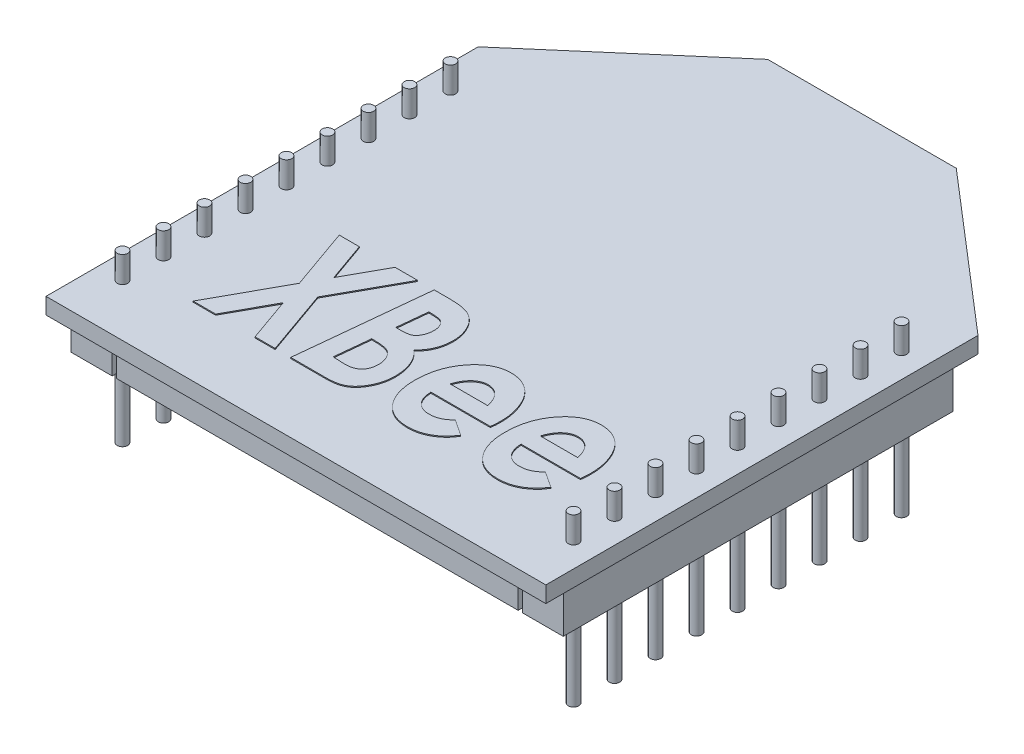
from build123d import *

# Parameters (mm, degrees)
BOSS_EXTRUDE2_DEPTH         = 0.79
SKETCH3_W                   = 2
SKETCH3_H                   = 19
SKETCH3_W_2                 = 19.6
BOSS_EXTRUDE3_DEPTH         = 2
BOSS_EXTRUDE4_DEPTH         = 1.27
BOSS_EXTRUDE4_DEPTH_BACK    = 6.85
SKETCH4_R                   = 0.255
BOSS_EXTRUDE4_2_DEPTH       = 1.27
BOSS_EXTRUDE4_2_DEPTH_BACK  = 6.85
BOSS_EXTRUDE4_3_DEPTH       = 1.27
BOSS_EXTRUDE4_3_DEPTH_BACK  = 6.85
BOSS_EXTRUDE4_4_DEPTH       = 1.27
BOSS_EXTRUDE4_4_DEPTH_BACK  = 6.85
BOSS_EXTRUDE4_5_DEPTH       = 1.27
BOSS_EXTRUDE4_5_DEPTH_BACK  = 6.85
BOSS_EXTRUDE4_6_DEPTH       = 1.27
BOSS_EXTRUDE4_6_DEPTH_BACK  = 6.85
BOSS_EXTRUDE4_7_DEPTH       = 1.27
BOSS_EXTRUDE4_7_DEPTH_BACK  = 6.85
BOSS_EXTRUDE4_8_DEPTH       = 1.27
BOSS_EXTRUDE4_8_DEPTH_BACK  = 6.85
BOSS_EXTRUDE4_9_DEPTH       = 1.27
BOSS_EXTRUDE4_9_DEPTH_BACK  = 6.85
BOSS_EXTRUDE4_10_DEPTH      = 1.27
BOSS_EXTRUDE4_10_DEPTH_BACK = 6.85
BOSS_EXTRUDE4_11_DEPTH      = 1.27
BOSS_EXTRUDE4_11_DEPTH_BACK = 6.85
BOSS_EXTRUDE4_12_DEPTH      = 1.27
BOSS_EXTRUDE4_12_DEPTH_BACK = 6.85
BOSS_EXTRUDE4_13_DEPTH      = 1.27
BOSS_EXTRUDE4_13_DEPTH_BACK = 6.85
BOSS_EXTRUDE4_14_DEPTH      = 1.27
BOSS_EXTRUDE4_14_DEPTH_BACK = 6.85
BOSS_EXTRUDE4_15_DEPTH      = 1.27
BOSS_EXTRUDE4_15_DEPTH_BACK = 6.85
BOSS_EXTRUDE4_16_DEPTH      = 1.27
BOSS_EXTRUDE4_16_DEPTH_BACK = 6.85
BOSS_EXTRUDE4_17_DEPTH      = 1.27
BOSS_EXTRUDE4_17_DEPTH_BACK = 6.85
BOSS_EXTRUDE4_18_DEPTH      = 1.27
BOSS_EXTRUDE4_18_DEPTH_BACK = 6.85
BOSS_EXTRUDE8_DEPTH         = 0.05
BOSS_EXTRUDE8_2_DEPTH       = 0.05
BOSS_EXTRUDE8_3_DEPTH       = 0.05
BOSS_EXTRUDE8_4_DEPTH       = 0.05


with BuildPart() as part:
    # Sketch1 → Boss-Extrude2 (new body)
    with BuildSketch(Plane(origin=(0, 0, 0), x_dir=(1, 0, 0), z_dir=(0, 1, 0))):
        Polygon((0, 0), (0, 21.08), (7.59, 27.61), (16.79, 27.61), (24.38, 21.08), (24.38, 0), align=None)
    extrude(amount=BOSS_EXTRUDE2_DEPTH)

    # Sketch3 → Boss-Extrude3 (add)
    with BuildSketch(Plane.XZ):
        with Locations((23.19, -10.54)):
            Rectangle(SKETCH3_W, SKETCH3_H)
        with Locations((1.19, -10.54)):
            Rectangle(SKETCH3_W, SKETCH3_H)
        with Locations((12.19, -10.54)):
            Rectangle(SKETCH3_W_2, SKETCH3_H)
    extrude(amount=BOSS_EXTRUDE3_DEPTH)


with BuildPart() as body_2:
    # Sketch4 → Boss-Extrude4 (new, two sides: drawn at the far end of the back side and taken through both)
    with BuildSketch(Plane(origin=(0, 0.79, 0), x_dir=(1, 0, 0), z_dir=(0, 1, 0)).offset(-BOSS_EXTRUDE4_DEPTH_BACK)):
        with Locations(Location((1.19, 10.54, 0), (0, 0, 270))):
            Circle(SKETCH4_R)
    extrude(amount=BOSS_EXTRUDE4_DEPTH + BOSS_EXTRUDE4_DEPTH_BACK)


with BuildPart() as body_3:
    # Sketch4 → Boss-Extrude4 2 (new, two sides: drawn at the far end of the back side and taken through both)
    with BuildSketch(Plane(origin=(0, 0.79, 0), x_dir=(1, 0, 0), z_dir=(0, 1, 0)).offset(-BOSS_EXTRUDE4_2_DEPTH_BACK)):
        with Locations(Location((1.19, 12.54, 0), (0, 0, 270))):
            Circle(SKETCH4_R)
    extrude(amount=BOSS_EXTRUDE4_2_DEPTH + BOSS_EXTRUDE4_2_DEPTH_BACK)


with BuildPart() as body_4:
    # Sketch4 → Boss-Extrude4 3 (new, two sides: drawn at the far end of the back side and taken through both)
    with BuildSketch(Plane(origin=(0, 0.79, 0), x_dir=(1, 0, 0), z_dir=(0, 1, 0)).offset(-BOSS_EXTRUDE4_3_DEPTH_BACK)):
        with Locations(Location((1.19, 14.54, 0), (0, 0, 270))):
            Circle(SKETCH4_R)
    extrude(amount=BOSS_EXTRUDE4_3_DEPTH + BOSS_EXTRUDE4_3_DEPTH_BACK)


with BuildPart() as body_5:
    # Sketch4 → Boss-Extrude4 4 (new, two sides: drawn at the far end of the back side and taken through both)
    with BuildSketch(Plane(origin=(0, 0.79, 0), x_dir=(1, 0, 0), z_dir=(0, 1, 0)).offset(-BOSS_EXTRUDE4_4_DEPTH_BACK)):
        with Locations(Location((1.19, 16.54, 0), (0, 0, 270))):
            Circle(SKETCH4_R)
    extrude(amount=BOSS_EXTRUDE4_4_DEPTH + BOSS_EXTRUDE4_4_DEPTH_BACK)


with BuildPart() as body_6:
    # Sketch4 → Boss-Extrude4 5 (new, two sides: drawn at the far end of the back side and taken through both)
    with BuildSketch(Plane(origin=(0, 0.79, 0), x_dir=(1, 0, 0), z_dir=(0, 1, 0)).offset(-BOSS_EXTRUDE4_5_DEPTH_BACK)):
        with Locations(Location((1.19, 18.54, 0), (0, 0, 270))):
            Circle(SKETCH4_R)
    extrude(amount=BOSS_EXTRUDE4_5_DEPTH + BOSS_EXTRUDE4_5_DEPTH_BACK)


with BuildPart() as body_7:
    # Sketch4 → Boss-Extrude4 6 (new, two sides: drawn at the far end of the back side and taken through both)
    with BuildSketch(Plane(origin=(0, 0.79, 0), x_dir=(1, 0, 0), z_dir=(0, 1, 0)).offset(-BOSS_EXTRUDE4_6_DEPTH_BACK)):
        with Locations(Location((1.19, 8.54, 0), (0, 0, 270))):
            Circle(SKETCH4_R)
    extrude(amount=BOSS_EXTRUDE4_6_DEPTH + BOSS_EXTRUDE4_6_DEPTH_BACK)


with BuildPart() as body_8:
    # Sketch4 → Boss-Extrude4 7 (new, two sides: drawn at the far end of the back side and taken through both)
    with BuildSketch(Plane(origin=(0, 0.79, 0), x_dir=(1, 0, 0), z_dir=(0, 1, 0)).offset(-BOSS_EXTRUDE4_7_DEPTH_BACK)):
        with Locations(Location((1.19, 6.54, 0), (0, 0, 270))):
            Circle(SKETCH4_R)
    extrude(amount=BOSS_EXTRUDE4_7_DEPTH + BOSS_EXTRUDE4_7_DEPTH_BACK)


with BuildPart() as body_9:
    # Sketch4 → Boss-Extrude4 8 (new, two sides: drawn at the far end of the back side and taken through both)
    with BuildSketch(Plane(origin=(0, 0.79, 0), x_dir=(1, 0, 0), z_dir=(0, 1, 0)).offset(-BOSS_EXTRUDE4_8_DEPTH_BACK)):
        with Locations(Location((1.19, 4.54, 0), (0, 0, 270))):
            Circle(SKETCH4_R)
    extrude(amount=BOSS_EXTRUDE4_8_DEPTH + BOSS_EXTRUDE4_8_DEPTH_BACK)


with BuildPart() as body_10:
    # Sketch4 → Boss-Extrude4 9 (new, two sides: drawn at the far end of the back side and taken through both)
    with BuildSketch(Plane(origin=(0, 0.79, 0), x_dir=(1, 0, 0), z_dir=(0, 1, 0)).offset(-BOSS_EXTRUDE4_9_DEPTH_BACK)):
        with Locations(Location((1.19, 2.54, 0), (0, 0, 270))):
            Circle(SKETCH4_R)
    extrude(amount=BOSS_EXTRUDE4_9_DEPTH + BOSS_EXTRUDE4_9_DEPTH_BACK)


with BuildPart() as body_11:
    # Sketch4 → Boss-Extrude4 10 (new, two sides: drawn at the far end of the back side and taken through both)
    with BuildSketch(Plane(origin=(0, 0.79, 0), x_dir=(1, 0, 0), z_dir=(0, 1, 0)).offset(-BOSS_EXTRUDE4_10_DEPTH_BACK)):
        with Locations(Location((23.19, 2.54, 0), (0, 0, 90))):
            Circle(SKETCH4_R)
    extrude(amount=BOSS_EXTRUDE4_10_DEPTH + BOSS_EXTRUDE4_10_DEPTH_BACK)


with BuildPart() as body_12:
    # Sketch4 → Boss-Extrude4 11 (new, two sides: drawn at the far end of the back side and taken through both)
    with BuildSketch(Plane(origin=(0, 0.79, 0), x_dir=(1, 0, 0), z_dir=(0, 1, 0)).offset(-BOSS_EXTRUDE4_11_DEPTH_BACK)):
        with Locations(Location((23.19, 4.54, 0), (0, 0, 90))):
            Circle(SKETCH4_R)
    extrude(amount=BOSS_EXTRUDE4_11_DEPTH + BOSS_EXTRUDE4_11_DEPTH_BACK)


with BuildPart() as body_13:
    # Sketch4 → Boss-Extrude4 12 (new, two sides: drawn at the far end of the back side and taken through both)
    with BuildSketch(Plane(origin=(0, 0.79, 0), x_dir=(1, 0, 0), z_dir=(0, 1, 0)).offset(-BOSS_EXTRUDE4_12_DEPTH_BACK)):
        with Locations(Location((23.19, 6.54, 0), (0, 0, 90))):
            Circle(SKETCH4_R)
    extrude(amount=BOSS_EXTRUDE4_12_DEPTH + BOSS_EXTRUDE4_12_DEPTH_BACK)


with BuildPart() as body_14:
    # Sketch4 → Boss-Extrude4 13 (new, two sides: drawn at the far end of the back side and taken through both)
    with BuildSketch(Plane(origin=(0, 0.79, 0), x_dir=(1, 0, 0), z_dir=(0, 1, 0)).offset(-BOSS_EXTRUDE4_13_DEPTH_BACK)):
        with Locations(Location((23.19, 8.54, 0), (0, 0, 90))):
            Circle(SKETCH4_R)
    extrude(amount=BOSS_EXTRUDE4_13_DEPTH + BOSS_EXTRUDE4_13_DEPTH_BACK)


with BuildPart() as body_15:
    # Sketch4 → Boss-Extrude4 14 (new, two sides: drawn at the far end of the back side and taken through both)
    with BuildSketch(Plane(origin=(0, 0.79, 0), x_dir=(1, 0, 0), z_dir=(0, 1, 0)).offset(-BOSS_EXTRUDE4_14_DEPTH_BACK)):
        with Locations(Location((23.19, 18.54, 0), (0, 0, 90))):
            Circle(SKETCH4_R)
    extrude(amount=BOSS_EXTRUDE4_14_DEPTH + BOSS_EXTRUDE4_14_DEPTH_BACK)


with BuildPart() as body_16:
    # Sketch4 → Boss-Extrude4 15 (new, two sides: drawn at the far end of the back side and taken through both)
    with BuildSketch(Plane(origin=(0, 0.79, 0), x_dir=(1, 0, 0), z_dir=(0, 1, 0)).offset(-BOSS_EXTRUDE4_15_DEPTH_BACK)):
        with Locations(Location((23.19, 16.54, 0), (0, 0, 90))):
            Circle(SKETCH4_R)
    extrude(amount=BOSS_EXTRUDE4_15_DEPTH + BOSS_EXTRUDE4_15_DEPTH_BACK)


with BuildPart() as body_17:
    # Sketch4 → Boss-Extrude4 16 (new, two sides: drawn at the far end of the back side and taken through both)
    with BuildSketch(Plane(origin=(0, 0.79, 0), x_dir=(1, 0, 0), z_dir=(0, 1, 0)).offset(-BOSS_EXTRUDE4_16_DEPTH_BACK)):
        with Locations(Location((23.19, 14.54, 0), (0, 0, 90))):
            Circle(SKETCH4_R)
    extrude(amount=BOSS_EXTRUDE4_16_DEPTH + BOSS_EXTRUDE4_16_DEPTH_BACK)


with BuildPart() as body_18:
    # Sketch4 → Boss-Extrude4 17 (new, two sides: drawn at the far end of the back side and taken through both)
    with BuildSketch(Plane(origin=(0, 0.79, 0), x_dir=(1, 0, 0), z_dir=(0, 1, 0)).offset(-BOSS_EXTRUDE4_17_DEPTH_BACK)):
        with Locations(Location((23.19, 12.54, 0), (0, 0, 90))):
            Circle(SKETCH4_R)
    extrude(amount=BOSS_EXTRUDE4_17_DEPTH + BOSS_EXTRUDE4_17_DEPTH_BACK)


with BuildPart() as body_19:
    # Sketch4 → Boss-Extrude4 18 (new, two sides: drawn at the far end of the back side and taken through both)
    with BuildSketch(Plane(origin=(0, 0.79, 0), x_dir=(1, 0, 0), z_dir=(0, 1, 0)).offset(-BOSS_EXTRUDE4_18_DEPTH_BACK)):
        with Locations(Location((23.19, 10.54, 0), (0, 0, 90))):
            Circle(SKETCH4_R)
    extrude(amount=BOSS_EXTRUDE4_18_DEPTH + BOSS_EXTRUDE4_18_DEPTH_BACK)


with BuildPart() as body_20:
    # Sketch6 → Boss-Extrude8 (new body)
    with BuildSketch(Plane(origin=(0, 0.79, 0), x_dir=(1, 0, 0), z_dir=(0, 1, 0))):
        Polygon((4.614192647, 9.688771644), (5.596203865, 9.688771644), (6.276742727, 7.764182301), (7.337620131, 9.688771644), (8.435386557, 9.688771644), (6.705418609, 6.550660667), (7.840074057, 3.338771644), (6.856790804, 3.338771644), (6.106290003, 5.464342558), (4.934745532, 3.338771644), (3.836979105, 3.338771644), (5.677614121, 6.677864192), align=None)
    extrude(amount=BOSS_EXTRUDE8_DEPTH)


with BuildPart() as body_21:
    # Sketch6 → Boss-Extrude8 2 (new body)
    with BuildSketch(Plane(origin=(0, 0.79, 0), x_dir=(1, 0, 0), z_dir=(0, 1, 0))):
        with BuildLine():
            Line((9.246945051, 9.688771644), (10.026702663, 9.688771644))
            add(Edge.make_bspline(
                [(10.026702663, 9.688771644), (10.084388685, 9.688572951), (10.195620935, 9.688189824), (10.356826161, 9.677115119), (10.506205225, 9.662243963), (10.64493952, 9.642702772), (10.771381446, 9.61452289), (10.887158296, 9.581594389), (10.991455616, 9.542984749), (11.11431963, 9.481185503), (11.252800368, 9.386158842), (11.40462435, 9.249659003), (11.533349341, 9.080749432), (11.647128654, 8.891659623), (11.739545212, 8.684553929), (11.80509259, 8.465607089), (11.848213327, 8.239070203), (11.852469363, 8.08493232), (11.854617326, 8.007141035)],
                knots=[0, 0, 0, 0, 0.975894446, 1.881754566, 2.732761623, 3.516110292, 4.250760301, 4.922908887, 5.551891901, 6.129461712, 7.2458477, 8.383428734, 9.569006701, 10.824104868, 12.112097696, 13.394482693, 14.685030986, 16, 16, 16, 16], degree=3))
            add(Edge.make_bspline(
                [(11.854617326, 8.007141035), (11.852927485, 7.941755942), (11.849588213, 7.812549316), (11.822293033, 7.621499152), (11.776053565, 7.436328619), (11.713145566, 7.258009525), (11.633360358, 7.089491725), (11.535960568, 6.934613455), (11.422731756, 6.793186014), (11.334974114, 6.711210173), (11.291105708, 6.670231981)],
                knots=[0, 0, 0, 0, 1.048957551, 2.072831274, 3.089421262, 4.107376656, 5.102609843, 6.074875552, 7.037666253, 8, 8, 8, 8], degree=3))
            add(Edge.make_bspline(
                [(11.291105708, 6.670231981), (11.342815189, 6.620080067), (11.445299303, 6.520682929), (11.576020566, 6.352322158), (11.68777032, 6.173471922), (11.778605116, 5.981717231), (11.850331291, 5.77810271), (11.898766347, 5.561539822), (11.930686786, 5.333847809), (11.934219908, 5.177823932), (11.936027583, 5.097996404)],
                knots=[0, 0, 0, 0, 0.985995519, 1.954165378, 2.911801336, 3.87072296, 4.855588123, 5.863254973, 6.906763013, 8, 8, 8, 8], degree=3))
            add(Edge.make_bspline(
                [(11.936027583, 5.097996404), (11.933758132, 5.014727184), (11.929285332, 4.850614089), (11.888626092, 4.610226449), (11.82264435, 4.38027047), (11.729360645, 4.16558742), (11.621491908, 3.968009924), (11.495445535, 3.797473893), (11.359151608, 3.652657237), (11.232404005, 3.554304916), (11.122497855, 3.49038473), (11.031584211, 3.449855854), (10.932323999, 3.415730623), (10.824186682, 3.388015962), (10.707962165, 3.364677275), (10.582408062, 3.350637319), (10.448798332, 3.339339837), (10.356611716, 3.338964903), (10.30909449, 3.338771644)],
                knots=[0, 0, 0, 0, 1.469776143, 2.8967428, 4.292714978, 5.685167174, 7.022871031, 8.260117555, 9.420157334, 10.52563317, 11.079270911, 11.662509173, 12.280667607, 12.930971386, 13.633033648, 14.372448833, 15.161085193, 16, 16, 16, 16], degree=3))
            Line((10.30909449, 3.338771644), (8.59820707, 3.338771644))
            Line((8.59820707, 3.338771644), (9.246945051, 9.688771644))
        make_face()
        with BuildLine():
            Line((9.893138961, 7.165053696), (10.072495932, 7.165053696))
            add(Edge.make_bspline(
                [(10.072495932, 7.165053696), (10.134007224, 7.165931872), (10.246196132, 7.167533555), (10.398568307, 7.180829329), (10.519235286, 7.202033408), (10.613900952, 7.233655152), (10.687741979, 7.282628622), (10.751375822, 7.344943514), (10.810224021, 7.421983676), (10.861034592, 7.513644018), (10.906147997, 7.61477045), (10.935255731, 7.724819267), (10.955841572, 7.839313599), (10.958001719, 7.917577012), (10.959104506, 7.95753166)],
                knots=[0, 0, 0, 0, 1.60032435, 2.918791578, 3.974691023, 4.784360933, 5.494310405, 6.258984406, 7.09308981, 8.00719273, 8.980683918, 9.965734359, 10.961476823, 12, 12, 12, 12], degree=3))
            add(Edge.make_bspline(
                [(10.959104506, 7.95753166), (10.958396009, 7.994080626), (10.957011043, 8.065526291), (10.938548945, 8.167940887), (10.910603608, 8.263002842), (10.871316269, 8.348903669), (10.823693384, 8.42490546), (10.768640113, 8.489015879), (10.704858788, 8.538382979), (10.64489386, 8.568649381), (10.59011448, 8.587754736), (10.539132038, 8.598204437), (10.47932058, 8.608376682), (10.410200186, 8.617446117), (10.3316563, 8.623512939), (10.243819469, 8.626890288), (10.14671285, 8.629545079), (10.07885817, 8.630130831), (10.043239121, 8.630438311)],
                knots=[0, 0, 0, 0, 1.315058415, 2.570667064, 3.735268981, 4.876803182, 5.961641154, 6.957440426, 7.904605142, 8.847325369, 9.36419389, 9.990463295, 10.718707533, 11.550451555, 12.500567713, 13.555529014, 14.716820544, 16, 16, 16, 16], degree=3))
            Line((10.043239121, 8.630438311), (9.893138961, 7.165053696))
        make_face(mode=Mode.SUBTRACT)
        with BuildLine():
            Line((9.610747134, 4.397104978), (10.197155387, 4.371664273))
            add(Edge.make_bspline(
                [(10.197155387, 4.371664273), (10.232799661, 4.372431828), (10.301694622, 4.373915394), (10.4011725, 4.384267421), (10.493281769, 4.400236547), (10.577891164, 4.424175622), (10.654160403, 4.456467213), (10.724209137, 4.493387866), (10.787016765, 4.537513631), (10.858227275, 4.608451955), (10.932745614, 4.711569925), (10.997234203, 4.855477126), (11.033711595, 5.020312769), (11.038175901, 5.136397883), (11.040514762, 5.197215154)],
                knots=[0, 0, 0, 0, 0.949502302, 1.835243548, 2.66173537, 3.437576639, 4.171842431, 4.864247976, 5.544474933, 6.207507029, 7.533859883, 8.909100507, 10.380670286, 12, 12, 12, 12], degree=3))
            add(Edge.make_bspline(
                [(11.040514762, 5.197215154), (11.039274533, 5.243133905), (11.036855933, 5.33268115), (11.011290995, 5.46293806), (10.972247129, 5.585831981), (10.917436782, 5.699819366), (10.851411849, 5.802612875), (10.772243004, 5.889820968), (10.682707185, 5.96017475), (10.598688719, 6.006166285), (10.522287002, 6.035527723), (10.451856216, 6.0517071), (10.3702962, 6.069346127), (10.276108687, 6.080440498), (10.170687985, 6.092903212), (10.053051975, 6.099632918), (9.923713664, 6.104899258), (9.833360031, 6.106096585), (9.786288, 6.106720362)],
                knots=[0, 0, 0, 0, 1.22801409, 2.394779379, 3.540082136, 4.67248285, 5.771438622, 6.800122652, 7.810794234, 8.806562507, 9.352687556, 9.997013741, 10.738443369, 11.586201183, 12.534023234, 13.580717588, 14.739613093, 16, 16, 16, 16], degree=3))
            Line((9.786288, 6.106720362), (9.610747134, 4.397104978))
        make_face(mode=Mode.SUBTRACT)
    extrude(amount=BOSS_EXTRUDE8_2_DEPTH)


with BuildPart() as body_22:
    # Sketch6 → Boss-Extrude8 3 (new body)
    with BuildSketch(Plane(origin=(0, 0.79, 0), x_dir=(1, 0, 0), z_dir=(0, 1, 0))):
        with BuildLine():
            Line((15.252223496, 4.711297686), (16.029437038, 4.199939513))
            add(Edge.make_bspline(
                [(16.029437038, 4.199939513), (15.98366363, 4.129980492), (15.893111825, 3.991583203), (15.727434596, 3.806749242), (15.540914784, 3.644715089), (15.335041685, 3.505841491), (15.112141127, 3.394277858), (14.874699398, 3.316009372), (14.626006346, 3.265051832), (14.455758151, 3.259948909), (14.369431028, 3.257361388)],
                knots=[0, 0, 0, 0, 1.003574201, 1.985332946, 2.971380164, 3.966340393, 4.962200571, 5.956429806, 6.963774428, 8, 8, 8, 8], degree=3))
            add(Edge.make_bspline(
                [(14.369431028, 3.257361388), (14.302327197, 3.258869409), (14.170898745, 3.261822994), (13.979586202, 3.290860512), (13.798362056, 3.335955214), (13.629058152, 3.401742882), (13.468928679, 3.482697587), (13.322369699, 3.586287415), (13.185397899, 3.70607648), (13.061128027, 3.84407385), (12.949030154, 3.99640738), (12.852809355, 4.162895339), (12.768866046, 4.340169176), (12.703744336, 4.530891432), (12.651427109, 4.732864984), (12.613079081, 4.946664255), (12.591853174, 5.173036902), (12.588849613, 5.327767725), (12.587309634, 5.407100971)],
                knots=[0, 0, 0, 0, 1.02238558, 2.002427451, 2.94315539, 3.86397137, 4.766034858, 5.671635364, 6.592337881, 7.535084861, 8.497051167, 9.470504302, 10.4624557, 11.482631688, 12.537843603, 13.641051432, 14.790525086, 16, 16, 16, 16], degree=3))
            add(Edge.make_bspline(
                [(12.587309634, 5.407100971), (12.588668753, 5.498361554), (12.591337494, 5.677559234), (12.622705984, 5.940044855), (12.666987484, 6.192736446), (12.73367802, 6.433750884), (12.817590795, 6.665338957), (12.922719957, 6.884549787), (13.043090575, 7.095321192), (13.184380013, 7.290126593), (13.335984592, 7.470339421), (13.499303993, 7.627106426), (13.66973003, 7.761281566), (13.84781258, 7.871234428), (14.034500839, 7.95668045), (14.229233376, 8.015786869), (14.431468614, 8.05491275), (14.569380764, 8.058668028), (14.639102503, 8.060566516)],
                knots=[0, 0, 0, 0, 1.177292805, 2.311711504, 3.407723301, 4.485811313, 5.535064, 6.582845514, 7.620111598, 8.663495855, 9.684521823, 10.656062175, 11.580071792, 12.479291213, 13.351198552, 14.221937114, 15.101097073, 16, 16, 16, 16], degree=3))
            add(Edge.make_bspline(
                [(14.639102503, 8.060566516), (14.68109976, 8.059353594), (14.764430211, 8.05694693), (14.887975389, 8.044884503), (15.007567175, 8.021046673), (15.124142641, 7.991345983), (15.236302604, 7.950165938), (15.344601673, 7.899798074), (15.451063528, 7.843280125), (15.55212086, 7.77494595), (15.65065304, 7.700751267), (15.742156098, 7.615969667), (15.828633632, 7.52367761), (15.9122787, 7.425345447), (15.98641377, 7.315661808), (16.05840336, 7.199987462), (16.124316596, 7.075474901), (16.203678194, 6.898062372), (16.289139043, 6.666364486), (16.361761974, 6.374745114), (16.406025598, 6.07162449), (16.411049596, 5.865183633), (16.413591685, 5.760726773)],
                knots=[0, 0, 0, 0, 0.777577212, 1.542859307, 2.293966405, 3.032546248, 3.767405895, 4.501343035, 5.242295665, 5.995409049, 6.756696972, 7.523225489, 8.300446187, 9.097270173, 9.909292085, 10.747844336, 11.618502894, 12.514162514, 14.343938179, 16.180718488, 18.067484516, 20, 20, 20, 20], degree=3))
            add(Edge.make_bspline(
                [(16.413591685, 5.760726773), (16.412830436, 5.725958071), (16.411251635, 5.653849195), (16.407023592, 5.540863865), (16.394302998, 5.419745625), (16.385207515, 5.335860704), (16.380518769, 5.292617798)],
                knots=[0, 0, 0, 0, 0.888845823, 1.843430163, 2.88828236, 4, 4, 4, 4], degree=3))
            Line((16.380518769, 5.292617798), (13.482822455, 5.292617798))
            add(Edge.make_bspline(
                [(13.482822455, 5.292617798), (13.487366798, 5.221505463), (13.496043486, 5.085727945), (13.544190448, 4.893462948), (13.618456726, 4.722878903), (13.706563116, 4.600953028), (13.787661845, 4.516635425), (13.855839895, 4.463965329), (13.927582592, 4.416271348), (14.006726638, 4.380800247), (14.090165959, 4.350265983), (14.179637405, 4.330947567), (14.274034837, 4.317360181), (14.338849503, 4.316258017), (14.371975099, 4.315694721)],
                knots=[0, 0, 0, 0, 1.722637075, 3.289097215, 4.773727274, 6.201335661, 6.905660456, 7.600034957, 8.283620767, 8.986446997, 9.694429871, 10.431739011, 11.198490355, 12, 12, 12, 12], degree=3))
            add(Edge.make_bspline(
                [(14.371975099, 4.315694721), (14.412727495, 4.31706632), (14.493768812, 4.319793919), (14.61357362, 4.3370727), (14.729098391, 4.370124353), (14.841226116, 4.41324305), (14.950791383, 4.468347069), (15.055593001, 4.537265186), (15.157442818, 4.6181359), (15.220119685, 4.679742221), (15.252223496, 4.711297686)],
                knots=[0, 0, 0, 0, 0.985519748, 1.959831208, 2.917440968, 3.884606586, 4.861180757, 5.876329416, 6.912231525, 8, 8, 8, 8], degree=3))
        make_face()
        with BuildLine():
            add(Edge.make_bspline(
                [(15.436668609, 6.106720362), (15.419686641, 6.176329392), (15.387314057, 6.309024509), (15.314832254, 6.49126954), (15.225198233, 6.646823631), (15.119554005, 6.775774626), (14.998707481, 6.876321865), (14.865769439, 6.949994946), (14.719957677, 6.994805856), (14.618211766, 6.99973344), (14.566596493, 7.002233183)],
                knots=[0, 0, 0, 0, 1.263798382, 2.409168385, 3.449078798, 4.421869117, 5.336196411, 6.207213357, 7.090526869, 8, 8, 8, 8], degree=3))
            add(Edge.make_bspline(
                [(14.566596493, 7.002233183), (14.514948627, 6.999787698), (14.411794788, 6.994903446), (14.262528586, 6.947534523), (14.120585477, 6.873482452), (13.98921919, 6.769619972), (13.868696292, 6.63964177), (13.763538511, 6.484643677), (13.673208891, 6.305459961), (13.629158342, 6.174792543), (13.606209875, 6.106720362)],
                knots=[0, 0, 0, 0, 0.877981817, 1.753551551, 2.642409551, 3.594987057, 4.592026125, 5.652341201, 6.776969367, 8, 8, 8, 8], degree=3))
            Line((13.606209875, 6.106720362), (15.436668609, 6.106720362))
        make_face(mode=Mode.SUBTRACT)
    extrude(amount=BOSS_EXTRUDE8_3_DEPTH)


with BuildPart() as body_23:
    # Sketch6 → Boss-Extrude8 4 (new body)
    with BuildSketch(Plane(origin=(0, 0.79, 0), x_dir=(1, 0, 0), z_dir=(0, 1, 0))):
        with BuildLine():
            Line((19.648377343, 4.711297686), (20.425590884, 4.199939513))
            add(Edge.make_bspline(
                [(20.425590884, 4.199939513), (20.379817476, 4.129980492), (20.289265672, 3.991583203), (20.123588442, 3.806749242), (19.93706863, 3.644715089), (19.731195531, 3.505841491), (19.508294974, 3.394277858), (19.270853245, 3.316009372), (19.022160193, 3.265051832), (18.851911997, 3.259948909), (18.765584875, 3.257361388)],
                knots=[0, 0, 0, 0, 1.003574201, 1.985332946, 2.971380164, 3.966340393, 4.962200571, 5.956429806, 6.963774428, 8, 8, 8, 8], degree=3))
            add(Edge.make_bspline(
                [(18.765584875, 3.257361388), (18.698481043, 3.258869409), (18.567052591, 3.261822994), (18.375740048, 3.290860512), (18.194515902, 3.335955214), (18.025211999, 3.401742882), (17.865082525, 3.482697587), (17.718523545, 3.586287415), (17.581551746, 3.70607648), (17.457281873, 3.84407385), (17.345184, 3.99640738), (17.248963201, 4.162895339), (17.165019892, 4.340169176), (17.099898183, 4.530891432), (17.047580955, 4.732864984), (17.009232927, 4.946664255), (16.988007021, 5.173036902), (16.98500346, 5.327767725), (16.98346348, 5.407100971)],
                knots=[0, 0, 0, 0, 1.02238558, 2.002427451, 2.94315539, 3.86397137, 4.766034858, 5.671635364, 6.592337881, 7.535084861, 8.497051167, 9.470504302, 10.4624557, 11.482631688, 12.537843603, 13.641051432, 14.790525086, 16, 16, 16, 16], degree=3))
            add(Edge.make_bspline(
                [(16.98346348, 5.407100971), (16.984822599, 5.498361554), (16.98749134, 5.677559234), (17.018859831, 5.940044855), (17.063141331, 6.192736446), (17.129831867, 6.433750884), (17.213744641, 6.665338957), (17.318873803, 6.884549787), (17.439244421, 7.095321192), (17.58053386, 7.290126593), (17.732138438, 7.470339421), (17.895457839, 7.627106426), (18.065883876, 7.761281566), (18.243966426, 7.871234428), (18.430654685, 7.95668045), (18.625387223, 8.015786869), (18.82762246, 8.05491275), (18.96553461, 8.058668028), (19.035256349, 8.060566516)],
                knots=[0, 0, 0, 0, 1.177292805, 2.311711504, 3.407723301, 4.485811313, 5.535064, 6.582845514, 7.620111598, 8.663495855, 9.684521823, 10.656062175, 11.580071792, 12.479291213, 13.351198552, 14.221937114, 15.101097073, 16, 16, 16, 16], degree=3))
            add(Edge.make_bspline(
                [(19.035256349, 8.060566516), (19.077253606, 8.059353594), (19.160584057, 8.05694693), (19.284129235, 8.044884503), (19.403721021, 8.021046673), (19.520296487, 7.991345983), (19.63245645, 7.950165938), (19.740755519, 7.899798074), (19.847217374, 7.843280125), (19.948274706, 7.77494595), (20.046806886, 7.700751267), (20.138309944, 7.615969667), (20.224787478, 7.52367761), (20.308432546, 7.425345447), (20.382567616, 7.315661808), (20.454557206, 7.199987462), (20.520470442, 7.075474901), (20.599832041, 6.898062372), (20.685292889, 6.666364486), (20.75791582, 6.374745114), (20.802179445, 6.07162449), (20.807203443, 5.865183633), (20.809745532, 5.760726773)],
                knots=[0, 0, 0, 0, 0.777577212, 1.542859307, 2.293966405, 3.032546248, 3.767405895, 4.501343035, 5.242295665, 5.995409049, 6.756696972, 7.523225489, 8.300446187, 9.097270173, 9.909292085, 10.747844336, 11.618502894, 12.514162514, 14.343938179, 16.180718488, 18.067484516, 20, 20, 20, 20], degree=3))
            add(Edge.make_bspline(
                [(20.809745532, 5.760726773), (20.808984282, 5.725958071), (20.807405481, 5.653849195), (20.803177438, 5.540863865), (20.790456844, 5.419745625), (20.781361361, 5.335860704), (20.776672615, 5.292617798)],
                knots=[0, 0, 0, 0, 0.888845823, 1.843430163, 2.88828236, 4, 4, 4, 4], degree=3))
            Line((20.776672615, 5.292617798), (17.878976301, 5.292617798))
            add(Edge.make_bspline(
                [(17.878976301, 5.292617798), (17.883520644, 5.221505463), (17.892197332, 5.085727945), (17.940344294, 4.893462948), (18.014610572, 4.722878903), (18.102716963, 4.600953028), (18.183815691, 4.516635425), (18.251993741, 4.463965329), (18.323736438, 4.416271348), (18.402880484, 4.380800247), (18.486319806, 4.350265983), (18.575791251, 4.330947567), (18.670188684, 4.317360181), (18.735003349, 4.316258017), (18.768128945, 4.315694721)],
                knots=[0, 0, 0, 0, 1.722637075, 3.289097215, 4.773727274, 6.201335661, 6.905660456, 7.600034957, 8.283620767, 8.986446997, 9.694429871, 10.431739011, 11.198490355, 12, 12, 12, 12], degree=3))
            add(Edge.make_bspline(
                [(18.768128945, 4.315694721), (18.808881341, 4.31706632), (18.889922658, 4.319793919), (19.009727466, 4.3370727), (19.125252237, 4.370124353), (19.237379963, 4.41324305), (19.34694523, 4.468347069), (19.451746847, 4.537265186), (19.553596664, 4.6181359), (19.616273531, 4.679742221), (19.648377343, 4.711297686)],
                knots=[0, 0, 0, 0, 0.985519748, 1.959831208, 2.917440968, 3.884606586, 4.861180757, 5.876329416, 6.912231525, 8, 8, 8, 8], degree=3))
        make_face()
        with BuildLine():
            add(Edge.make_bspline(
                [(19.832822455, 6.106720362), (19.815840487, 6.176329392), (19.783467903, 6.309024509), (19.710986101, 6.49126954), (19.621352079, 6.646823631), (19.515707851, 6.775774626), (19.394861327, 6.876321865), (19.261923285, 6.949994946), (19.116111523, 6.994805856), (19.014365612, 6.99973344), (18.962750339, 7.002233183)],
                knots=[0, 0, 0, 0, 1.263798382, 2.409168385, 3.449078798, 4.421869117, 5.336196411, 6.207213357, 7.090526869, 8, 8, 8, 8], degree=3))
            add(Edge.make_bspline(
                [(18.962750339, 7.002233183), (18.911102474, 6.999787698), (18.807948634, 6.994903446), (18.658682432, 6.947534523), (18.516739323, 6.873482452), (18.385373036, 6.769619972), (18.264850138, 6.63964177), (18.159692357, 6.484643677), (18.069362737, 6.305459961), (18.025312188, 6.174792543), (18.002363721, 6.106720362)],
                knots=[0, 0, 0, 0, 0.877981817, 1.753551551, 2.642409551, 3.594987057, 4.592026125, 5.652341201, 6.776969367, 8, 8, 8, 8], degree=3))
            Line((18.002363721, 6.106720362), (19.832822455, 6.106720362))
        make_face(mode=Mode.SUBTRACT)
    extrude(amount=BOSS_EXTRUDE8_4_DEPTH)


solid = Compound([part.part, body_2.part, body_3.part, body_4.part, body_5.part, body_6.part, body_7.part, body_8.part, body_9.part, body_10.part, body_11.part, body_12.part, body_13.part, body_14.part, body_15.part, body_16.part, body_17.part, body_18.part, body_19.part, body_20.part, body_21.part, body_22.part, body_23.part])
